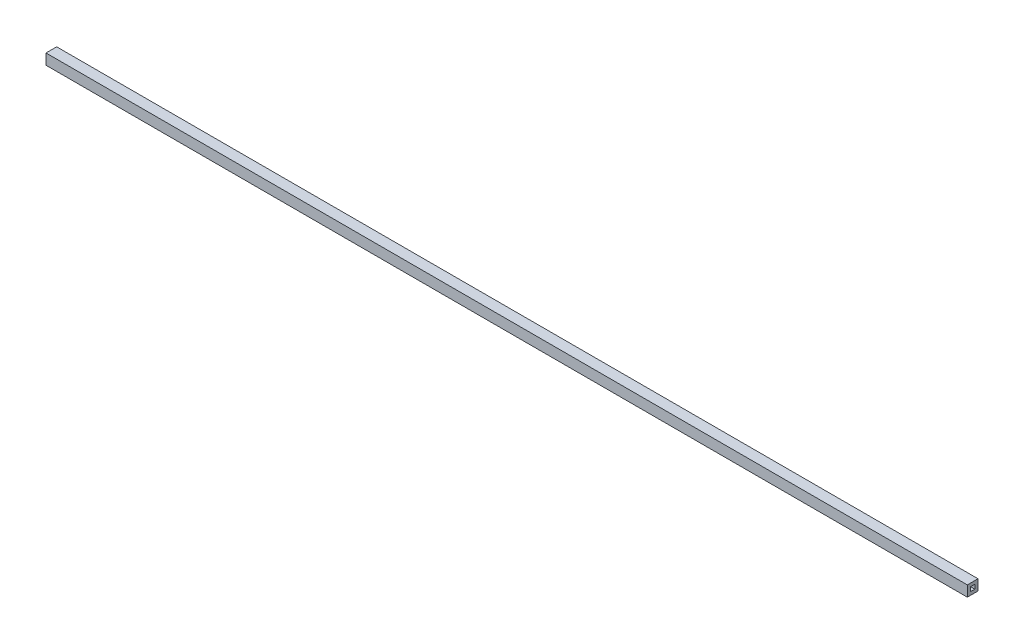
from build123d import *

# Parameters (mm, degrees)
SKETCH1_W           = 5
SKETCH1_H           = 5
SKETCH1_W_2         = 2
SKETCH1_H_2         = 2
BOSS_EXTRUDE1_DEPTH = 432


with BuildPart() as part:
    # Sketch1 → Boss-Extrude1 (new body)
    with BuildSketch(Plane(origin=(0, 0, 0), x_dir=(0, 0, -1), z_dir=(1, 0, 0))):
        Rectangle(SKETCH1_W, SKETCH1_H)
        Rectangle(SKETCH1_W_2, SKETCH1_H_2, mode=Mode.SUBTRACT)
    extrude(amount=BOSS_EXTRUDE1_DEPTH)


solid = part.part
